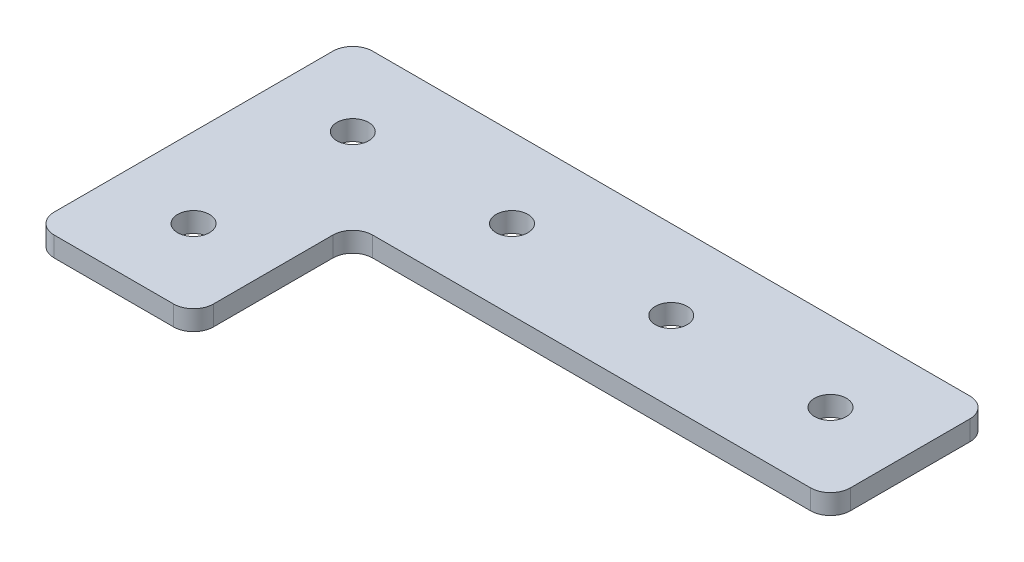
from build123d import *

# Parameters (mm, degrees)
SKETCH1_R           = 2.54
SKETCH1_W           = 76.2
SKETCH1_H           = 25.4
BOSS_EXTRUDE1_DEPTH = 3.175
FILLET1_R           = 3.175


with BuildPart() as part:
    # Sketch1 → Boss-Extrude1 (new body)
    # profile 1 of 2: a face of its own
    with BuildSketch(Plane(origin=(0, 0, 0), x_dir=(1, 0, 0), z_dir=(0, 1, 0))):
        Polygon((12.7, 12.7), (-12.7, 12.7), (-12.7, -38.1), (12.7, -38.1), (12.7, -12.7), align=None)
        with Locations(Location((0, -25.4, 0), (0, 0, 270))):
            Circle(SKETCH1_R, mode=Mode.SUBTRACT)
        with Locations(Location((0, 0, 0), (0, 0, 270))):
            Circle(SKETCH1_R, mode=Mode.SUBTRACT)
    # profile 2 of 2: a face of its own
    with BuildSketch(Plane(origin=(0, 0, 0), x_dir=(1, 0, 0), z_dir=(0, 1, 0))):
        with Locations((50.8, 0)):
            Rectangle(SKETCH1_W, SKETCH1_H)
        with Locations(Location((25.4, 0, 0), (0, 0, 270))):
            Circle(SKETCH1_R, mode=Mode.SUBTRACT)
        with Locations(Location((50.8, 0, 0), (0, 0, 270))):
            Circle(SKETCH1_R, mode=Mode.SUBTRACT)
        with Locations(Location((76.2, 0, 0), (0, 0, 270))):
            Circle(SKETCH1_R, mode=Mode.SUBTRACT)
    extrude(amount=BOSS_EXTRUDE1_DEPTH)

    # Fillet1
    fillet1_edges = [part.edges().sort_by_distance(p)[0] for p in [
        (12.7, 1.5875, 38.1),
        (-12.7, 1.5875, 38.1),
        (-12.7, 1.5875, -12.7),
        (88.9, 1.5875, -12.7),
        (88.9, 1.5875, 12.7),
        (12.7, 1.5875, 12.7),
    ]]
    fillet(fillet1_edges, radius=FILLET1_R)


solid = part.part
